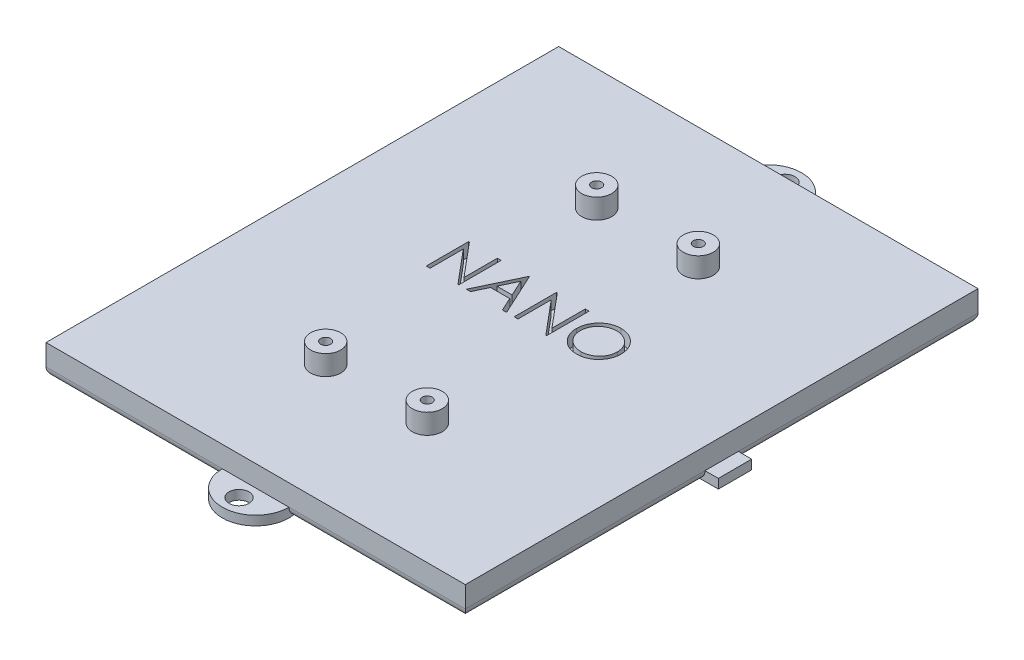
from build123d import *

# Parameters (mm, degrees)
SKETCH1_W           = 62.9
SKETCH1_H           = 76.9
BOSS_EXTRUDE1_DEPTH = 4.575
SKETCH4_R           = 1.5
BOSS_EXTRUDE3_DEPTH = 1.4
SKETCH6_W           = 5
SKETCH6_H           = 1.4
BOSS_EXTRUDE4_DEPTH = 2
FILLET1_R           = 1.4
SKETCH2_R           = 2.25
SKETCH2_R_2         = 0.75
BOSS_EXTRUDE2_DEPTH = 3
CUT_EXTRUDE1_START  = -3.575
SKETCH3_R           = 0.75
CUT_EXTRUDE1_DEPTH  = 3.575
LETTERS_DEPTH       = 2


with BuildPart() as part:
    # Sketch1 → Boss-Extrude1 (new body)
    with BuildSketch(Plane(origin=(0, 0, 0), x_dir=(1, 0, 0), z_dir=(0, 1, 0))):
        Rectangle(SKETCH1_W, SKETCH1_H)
    extrude(amount=BOSS_EXTRUDE1_DEPTH)

    # Sketch4 → Boss-Extrude3 (add)
    with BuildSketch(Plane(origin=(0, 0, 0), x_dir=(1, 0, 0), z_dir=(0, 1, 0))):
        with BuildLine():
            Line((-5, -38.45), (5, -38.45))
            ThreePointArc((5, -38.45), (0, -43.45), (-5, -38.45))
        make_face()
        with Locations(Location((0, -40.95, 0), (0, 0, 270))):
            Circle(SKETCH4_R, mode=Mode.SUBTRACT)
    boss_extrude3 = extrude(amount=BOSS_EXTRUDE3_DEPTH)

    # Sketch6 → Boss-Extrude4 (add)
    with BuildSketch(Plane.ZY.offset(31.45)):
        with Locations((0, 0.7)):
            Rectangle(SKETCH6_W, SKETCH6_H)
    boss_extrude4 = extrude(amount=BOSS_EXTRUDE4_DEPTH)

    # Mirror2: Boss-Extrude4 across plane
    add(boss_extrude4.mirror(Plane(origin=(0, 0, 0), x_dir=(0, 0, 1), z_dir=(1, 0, 0))))

    # Mirror1: Boss-Extrude3 across plane
    add(boss_extrude3.mirror(Plane.XY))

    # Fillet1
    fillet1_edges = [part.edges().sort_by_distance(p)[0] for p in [
        (-18.225, 0, 38.45),
        (18.225, 0, 38.45),
        (31.45, 0, -20.475),
        (31.45, 0, 20.475),
        (18.225, 0, -38.45),
        (-18.225, 0, -38.45),
        (-31.45, 0, 20.475),
        (-31.45, 0, -20.475),
    ]]
    fillet(fillet1_edges, radius=FILLET1_R)

    # Sketch2 → Boss-Extrude2 (add)
    # profile 1 of 4: a face of its own
    with BuildSketch(Plane(origin=(0, 4.575, 0), x_dir=(1, 0, 0), z_dir=(0, 1, 0))):
        with Locations(Location((-7.6205, -20.3255, 0), (0, 0, 270))):
            Circle(SKETCH2_R)
        with Locations(Location((-7.6205, -20.3255, 0), (0, 0, 270))):
            Circle(SKETCH2_R_2, mode=Mode.SUBTRACT)
    # profile 2 of 4: a face of its own
    with BuildSketch(Plane(origin=(0, 4.575, 0), x_dir=(1, 0, 0), z_dir=(0, 1, 0))):
        with Locations(Location((7.6205, -20.3255, 0), (0, 0, 270))):
            Circle(SKETCH2_R)
        with Locations(Location((7.6205, -20.3255, 0), (0, 0, 270))):
            Circle(SKETCH2_R_2, mode=Mode.SUBTRACT)
    # profile 3 of 4: a face of its own
    with BuildSketch(Plane(origin=(0, 4.575, 0), x_dir=(1, 0, 0), z_dir=(0, 1, 0))):
        with Locations(Location((7.6205, 20.3255, 0), (0, 0, 270))):
            Circle(SKETCH2_R)
        with Locations(Location((7.6205, 20.3255, 0), (0, 0, 270))):
            Circle(SKETCH2_R_2, mode=Mode.SUBTRACT)
    # profile 4 of 4: a face of its own
    with BuildSketch(Plane(origin=(0, 4.575, 0), x_dir=(1, 0, 0), z_dir=(0, 1, 0))):
        with Locations(Location((-7.6205, 20.3255, 0), (0, 0, 270))):
            Circle(SKETCH2_R)
        with Locations(Location((-7.6205, 20.3255, 0), (0, 0, 270))):
            Circle(SKETCH2_R_2, mode=Mode.SUBTRACT)
    extrude(amount=BOSS_EXTRUDE2_DEPTH)

    # Sketch3 → Cut-Extrude1 (cut)
    with BuildSketch(Plane(origin=(0, 4.575, 0), x_dir=(1, 0, 0), z_dir=(0, 1, 0)).offset(CUT_EXTRUDE1_START)):
        with Locations(Location((7.6205, -20.3255, 0), (0, 0, 270))):
            Circle(SKETCH3_R)
        with Locations(Location((-7.6205, -20.3255, 0), (0, 0, 270))):
            Circle(SKETCH3_R)
        with Locations(Location((-7.6205, 20.3255, 0), (0, 0, 270))):
            Circle(SKETCH3_R)
        with Locations(Location((7.6205, 20.3255, 0), (0, 0, 270))):
            Circle(SKETCH3_R)
    extrude(amount=CUT_EXTRUDE1_DEPTH, mode=Mode.SUBTRACT)

    # Sketch5 → Letters (cut)
    # profile 1 of 4: a face of its own
    with BuildSketch(Plane(origin=(0, 4.575, 0), x_dir=(1, 0, 0), z_dir=(0, 1, 0))):
        Polygon((-12.862820513, 0), (-12.862820513, 6.35), (-12.743249199, 6.35), (-8.548076923, 1.352173478), (-8.548076923, 6.35), (-7.978205128, 6.35), (-7.978205128, 0), (-8.107952724, 0), (-12.292948718, 4.986378205), (-12.292948718, 0), align=None)
    # profile 2 of 4: a face of its own
    with BuildSketch(Plane(origin=(0, 4.575, 0), x_dir=(1, 0, 0), z_dir=(0, 1, 0))):
        Polygon((-3.744871795, 6.35), (-0.814102564, 0), (-1.433583734, 0), (-2.372345753, 2.03525641), (-5.250961538, 2.03525641), (-6.216436298, 0), (-6.838461538, 0), (-3.826282051, 6.35), align=None)
        Polygon((-3.791937099, 5.112309696), (-4.941856971, 2.686538462), (-2.672546074, 2.686538462), align=None, mode=Mode.SUBTRACT)
    # profile 3 of 4: a face of its own
    with BuildSketch(Plane(origin=(0, 4.575, 0), x_dir=(1, 0, 0), z_dir=(0, 1, 0))):
        Polygon((0.325641026, 0), (0.325641026, 6.35), (0.44521234, 6.35), (4.640384615, 1.352173478), (4.640384615, 6.35), (5.21025641, 6.35), (5.21025641, 0), (5.080508814, 0), (0.895512821, 4.986378205), (0.895512821, 0), align=None)
    # profile 4 of 4: a face of its own
    with BuildSketch(Plane(origin=(0, 4.575, 0), x_dir=(1, 0, 0), z_dir=(0, 1, 0))):
        with BuildLine():
            add(Edge.make_bspline(
                [(9.809935897, 6.512820513), (9.927516318, 6.5098424), (10.158453965, 6.503993141), (10.49786128, 6.459218196), (10.82188381, 6.38175656), (11.133161062, 6.278590864), (11.427969748, 6.140969336), (11.708528881, 5.974626281), (11.974170924, 5.777818991), (12.22131543, 5.552068823), (12.447478754, 5.306444556), (12.646734291, 5.044320348), (12.813725309, 4.767281093), (12.950859523, 4.4761593), (13.058444144, 4.171613358), (13.13268298, 3.852019667), (13.180105053, 3.519448958), (13.185649106, 3.292614503), (13.188461538, 3.177544071)],
                knots=[0, 0, 0, 0, 1.065120563, 2.091984664, 3.0946048, 4.079830382, 5.057816894, 6.036188127, 7.030412546, 8.04752943, 9.064399622, 10.05169764, 11.02544977, 11.989514704, 12.962713494, 13.945757189, 14.957906945, 16, 16, 16, 16], degree=3))
            add(Edge.make_bspline(
                [(13.188461538, 3.177544071), (13.185649518, 3.063321275), (13.1801067, 2.838174912), (13.132629061, 2.507714663), (13.058168961, 2.190050114), (12.951858592, 1.885711573), (12.815378081, 1.594377993), (12.647275128, 1.316815948), (12.449261788, 1.052934444), (12.223915073, 0.805624322), (11.978258897, 0.578843197), (11.714769698, 0.381233237), (11.439373246, 0.211190896), (11.148525633, 0.075511945), (10.846084138, -0.032931396), (10.529341923, -0.106868311), (10.199783175, -0.154560518), (9.975045782, -0.160036968), (9.860817308, -0.162820513)],
                knots=[0, 0, 0, 0, 1.043624062, 2.057103931, 3.04512605, 4.022047818, 4.998200453, 5.980619268, 6.982898556, 8.009068085, 9.034988726, 10.034168286, 11.015286542, 11.987931943, 12.962482838, 13.94673481, 14.956375938, 16, 16, 16, 16], degree=3))
            add(Edge.make_bspline(
                [(9.860817308, -0.162820513), (9.745747472, -0.160009482), (9.518914194, -0.154468193), (9.185925573, -0.106967644), (8.866107381, -0.032688422), (8.560374201, 0.073464412), (8.268555543, 0.210655674), (7.990080678, 0.377940762), (7.726067368, 0.576436575), (7.478704485, 0.801710217), (7.252373797, 1.046950033), (7.055053216, 1.309720753), (6.88773051, 1.584867082), (6.750999892, 1.87315259), (6.642751516, 2.173183636), (6.568901346, 2.486961588), (6.521120405, 2.812697548), (6.515614326, 3.034481092), (6.512820513, 3.147015224)],
                knots=[0, 0, 0, 0, 1.053102029, 2.075944431, 3.073151272, 4.055350789, 5.033113405, 6.020478099, 7.024410459, 8.052272461, 9.079885166, 10.07527673, 11.055994387, 12.023226415, 12.992069828, 13.970394897, 14.97016774, 16, 16, 16, 16], degree=3))
            add(Edge.make_bspline(
                [(6.512820513, 3.147015224), (6.513790494, 3.222548781), (6.515718221, 3.372663005), (6.538926006, 3.595578123), (6.572602235, 3.814908316), (6.620865705, 4.030029893), (6.683987729, 4.240416251), (6.758467836, 4.447518349), (6.849435841, 4.649237391), (6.952270731, 4.846528973), (7.067045726, 5.036317602), (7.1938203, 5.215713417), (7.328141611, 5.386221797), (7.475395197, 5.543424219), (7.63072789, 5.691893852), (7.796659519, 5.829349067), (7.972177591, 5.957029336), (8.158037337, 6.072091954), (8.349659064, 6.176157813), (8.547192647, 6.265460314), (8.747955284, 6.34210674), (8.952887288, 6.40422938), (9.16144446, 6.453273217), (9.374081984, 6.486669416), (9.590630457, 6.509936392), (9.736519564, 6.511855003), (9.809935897, 6.512820513)],
                knots=[0, 0, 0, 0, 1.037015668, 2.060948919, 3.074880161, 4.083647147, 5.086022904, 6.090072063, 7.104153813, 8.122640571, 9.144368836, 10.147691507, 11.138137339, 12.123020368, 13.103399296, 14.087645067, 15.080126199, 16.082011238, 17.087798457, 18.072939717, 19.057185487, 20.037253025, 21.01195951, 21.997135196, 22.992090687, 24, 24, 24, 24], degree=3))
        make_face()
        with BuildLine():
            add(Edge.make_bspline(
                [(9.837920673, 5.861538462), (9.777659838, 5.860803875), (9.657714265, 5.859341724), (9.479398035, 5.840081783), (9.303426955, 5.812631842), (9.129764684, 5.773476797), (8.959137845, 5.720129444), (8.78995599, 5.658732368), (8.623761878, 5.583945532), (8.461104164, 5.49944934), (8.303415385, 5.405924869), (8.154620913, 5.302561806), (8.014335544, 5.191784144), (7.88290276, 5.073333353), (7.760708491, 4.946606218), (7.645347675, 4.813523941), (7.541444292, 4.670282653), (7.446220459, 4.520766629), (7.361007378, 4.365170618), (7.285233091, 4.205132725), (7.223249818, 4.039347493), (7.172699507, 3.869613521), (7.13078985, 3.69619963), (7.104239731, 3.517790305), (7.084768164, 3.33528203), (7.083389587, 3.211943523), (7.082692308, 3.149559295)],
                knots=[0, 0, 0, 0, 1.008559885, 2.007477868, 2.99961109, 3.989939068, 4.984837346, 5.991145699, 7.001802488, 8.033829008, 9.059044045, 10.069351652, 11.065060232, 12.050310815, 13.029377138, 14.011219647, 14.996725999, 15.989392538, 16.977580475, 17.965360261, 18.951710183, 19.937753436, 20.929683414, 21.935841486, 22.955955122, 24, 24, 24, 24], degree=3))
            add(Edge.make_bspline(
                [(7.082692308, 3.149559295), (7.085005272, 3.05782498), (7.089555587, 2.877355204), (7.129392893, 2.612890143), (7.190755618, 2.358729966), (7.281211125, 2.116265359), (7.394332955, 1.88341216), (7.534081742, 1.662236027), (7.699651797, 1.452677184), (7.887727052, 1.256198625), (8.09332682, 1.076864094), (8.311644773, 0.919450481), (8.540342032, 0.786263314), (8.780014986, 0.677759825), (9.029384092, 0.591781301), (9.29005622, 0.532855784), (9.560294911, 0.494074601), (9.744500529, 0.490350315), (9.837920673, 0.488461538)],
                knots=[0, 0, 0, 0, 1.032063989, 2.030389145, 3.003944642, 3.970395727, 4.937377036, 5.913328081, 6.909231446, 7.93887556, 8.970685674, 9.976071282, 10.964166581, 11.944589148, 12.933237628, 13.927779006, 14.949070134, 16, 16, 16, 16], degree=3))
            add(Edge.make_bspline(
                [(9.837920673, 0.488461538), (9.900712197, 0.489324239), (10.025246649, 0.491035234), (10.210477097, 0.508268548), (10.39237051, 0.535903511), (10.57067176, 0.575691986), (10.745178489, 0.62548906), (10.916619061, 0.684648795), (11.083167388, 0.758456122), (11.246924522, 0.840004549), (11.403671989, 0.932968834), (11.553306169, 1.032823763), (11.692055447, 1.143438261), (11.823389905, 1.260129149), (11.946085855, 1.385249273), (12.059313583, 1.518635961), (12.162691823, 1.661131154), (12.257879496, 1.81042039), (12.342793987, 1.966442163), (12.416778924, 2.127060293), (12.479546163, 2.291879277), (12.53021645, 2.461136842), (12.569922931, 2.634511525), (12.597282214, 2.812235467), (12.616420095, 2.993953131), (12.617862593, 3.116859841), (12.618589744, 3.178816106)],
                knots=[0, 0, 0, 0, 1.047197238, 2.076906641, 3.100256066, 4.114471768, 5.12198147, 6.126382909, 7.136867548, 8.15857795, 9.17633901, 10.174870724, 11.156907918, 12.133735059, 13.104061851, 14.077631395, 15.04955518, 16.038496417, 17.029181396, 18.010275684, 18.986308667, 19.968651475, 20.955262928, 21.950658345, 22.966943676, 24, 24, 24, 24], degree=3))
            add(Edge.make_bspline(
                [(12.618589744, 3.178816106), (12.61786201, 3.240348521), (12.616418417, 3.3624094), (12.597291355, 3.542859742), (12.569894026, 3.719304854), (12.530410255, 3.89105204), (12.479519262, 4.058145078), (12.416767963, 4.220427035), (12.342771777, 4.378502474), (12.257848284, 4.531980699), (12.162388147, 4.679254866), (12.058077163, 4.820047815), (11.943114317, 4.951715503), (11.820784243, 5.077508448), (11.688031351, 5.194743762), (11.545456989, 5.303460335), (11.394792031, 5.406281847), (11.235266904, 5.499038223), (11.070631445, 5.584698331), (10.901696121, 5.658088008), (10.730374754, 5.720448853), (10.557103008, 5.773638204), (10.380422461, 5.812478488), (10.201526943, 5.840106521), (10.02066396, 5.859335021), (9.899028404, 5.860801651), (9.837920673, 5.861538462)],
                knots=[0, 0, 0, 0, 1.02996197, 2.043119294, 3.035359645, 4.018872909, 4.991431989, 5.957985074, 6.929999688, 7.912076566, 8.892894881, 9.867085534, 10.843653904, 11.817741046, 12.803660682, 13.806313499, 14.818574707, 15.856120519, 16.894564902, 17.924820532, 18.937903209, 19.946497019, 20.957711757, 21.963978472, 22.977135795, 24, 24, 24, 24], degree=3))
        make_face(mode=Mode.SUBTRACT)
    extrude(amount=-LETTERS_DEPTH, mode=Mode.SUBTRACT)


solid = part.part
